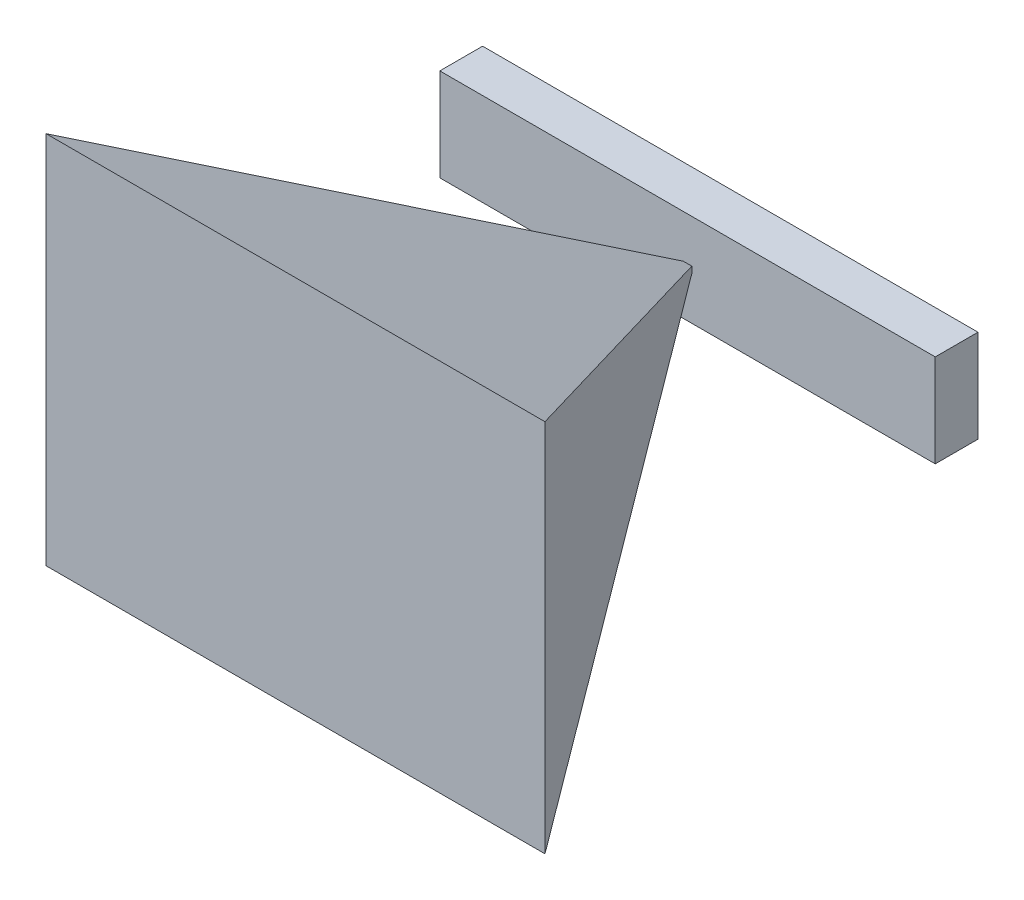
from build123d import *

# Parameters (mm, degrees)
SKETCH_1_W          = 139
SKETCH_1_H          = 26
EXTRUDE_1_DEPTH     = 12
SKETCH_2_R          = 1.2
CUT_EXTRUDE_1_DEPTH = 5


with BuildPart() as part:
    # 草图1 → 凸台-拉伸1 (new body)
    with BuildSketch(Plane.XY):
        Rectangle(SKETCH_1_W, SKETCH_1_H)
    extrude(amount=EXTRUDE_1_DEPTH)

    # 草图2 → 切除-拉伸1 (cut)
    with BuildSketch(Plane(origin=(0, 0, 0), x_dir=(-1, 0, 0), z_dir=(0, 0, -1))):
        with Locations((-25, 0)):
            Circle(SKETCH_2_R)
        with Locations(Location((25, 0, 0), (0, 0, 180))):
            Circle(SKETCH_2_R)
    extrude(amount=-CUT_EXTRUDE_1_DEPTH, mode=Mode.SUBTRACT)


with BuildPart() as body_2:
    # 草图5 → 放样1 section 0
    with BuildSketch(Plane.XY.offset(12)):
        with BuildLine():
            Line((-1.2, -0.9), (1.2, -0.9))
            Line((1.2, -0.9), (1.2, 0.9))
            Line((1.2, 0.9), (-1.2, 0.9))
            Line((-1.2, 0.9), (-1.2, -0.9))
        make_face()
    # 草图4 → 放样1 section 1
    with BuildSketch(Plane.XY.offset(122)):
        with BuildLine():
            Line((-70, -52.5), (70, -52.5))
            Line((70, -52.5), (70, 52.5))
            Line((70, 52.5), (-70, 52.5))
            Line((-70, 52.5), (-70, -52.5))
        make_face()
    loft()


solid = Compound([part.part, body_2.part])
